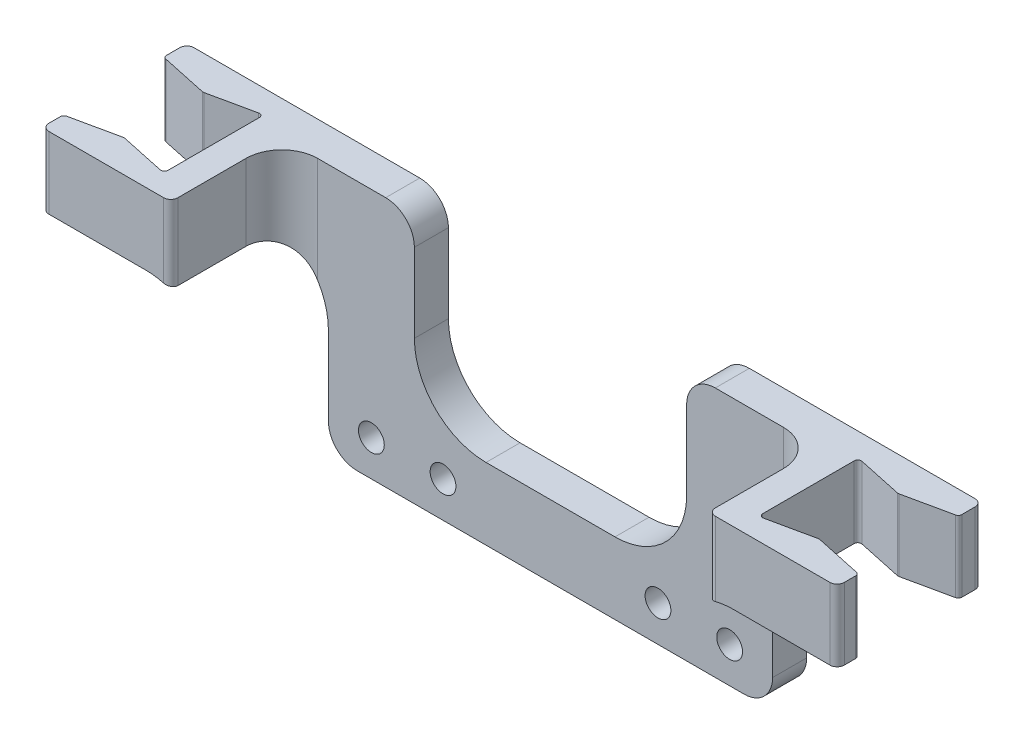
from build123d import *

# Parameters (mm, degrees)
SKETCH_1_W          = 111
SKETCH_1_H          = 35
SKETCH_1_R          = 1.8
EXTRUDE_1_DEPTH     = 4.75
SKETCH_2_W          = 4
SKETCH_2_H          = 35
EXTRUDE_2_DEPTH     = 15.5
SKETCH_3_W          = 4.5
SKETCH_3_H          = 35
EXTRUDE_3_DEPTH     = 14
SKETCH_4_W          = 4.5
SKETCH_4_H          = 35
EXTRUDE_4_DEPTH     = 14
FILLET_1_R          = 5
FILLET_2_R          = 1
SKETCH_5_W          = 20
SKETCH_5_H          = 2
CUT_EXTRUDE_1_DEPTH = 1
CUT_EXTRUDE_2_DEPTH = 200
SKETCH_8_W          = 33.5
SKETCH_8_H          = 25
SKETCH_8_W_2        = 38
CUT_EXTRUDE_3_DEPTH = 1000
FILLET_8_R          = 10
FILLET_9_R          = 4
FILLET_10_R         = 0.5


with BuildPart() as part:
    # ｽｹｯﾁ1 → ﾎﾞｽ - 押し出し1 (new body)
    with BuildSketch(Plane.XY):
        with Locations((0, -98.5)):
            Rectangle(SKETCH_1_W, SKETCH_1_H)
        with Locations((25, -111)):
            Circle(SKETCH_1_R, mode=Mode.SUBTRACT)
        with Locations((15, -111)):
            Circle(SKETCH_1_R, mode=Mode.SUBTRACT)
        with Locations((-15, -111)):
            Circle(SKETCH_1_R, mode=Mode.SUBTRACT)
        with Locations((-25, -111)):
            Circle(SKETCH_1_R, mode=Mode.SUBTRACT)
    extrude(amount=EXTRUDE_1_DEPTH)

    # ｽｹｯﾁ2 → ﾎﾞｽ - 押し出し2 (add)
    with BuildSketch(Plane.XY.offset(4.75)):
        with Locations((39.5, -98.5)):
            Rectangle(SKETCH_2_W, SKETCH_2_H)
        with Locations((-39.5, -98.5)):
            Rectangle(SKETCH_2_W, SKETCH_2_H)
    extrude(amount=EXTRUDE_2_DEPTH)

    # ｽｹｯﾁ3 → ﾎﾞｽ - 押し出し3 (add)
    with BuildSketch(Plane(origin=(41.5, 0, 0), x_dir=(0, 0, -1), z_dir=(1, 0, 0))):
        with Locations((-18, -98.5)):
            Rectangle(SKETCH_3_W, SKETCH_3_H)
    extrude(amount=EXTRUDE_3_DEPTH)

    # ｽｹｯﾁ4 → ﾎﾞｽ - 押し出し4 (add)
    with BuildSketch(Plane.ZY.offset(41.5)):
        with Locations((18, -98.5)):
            Rectangle(SKETCH_4_W, SKETCH_4_H)
    extrude(amount=EXTRUDE_4_DEPTH)

    # ﾌｨﾚｯﾄ1
    fillet_1_edges = [part.edges().sort_by_distance(p)[0] for p in [
        (37.5, -98.5, 4.75),
        (-37.5, -98.5, 4.75),
    ]]
    fillet(fillet_1_edges, radius=FILLET_1_R)

    # ﾌｨﾚｯﾄ2
    fillet_2_edges = [part.edges().sort_by_distance(p)[0] for p in [
        (37.5, -98.5, 20.25),
        (-37.5, -98.5, 20.25),
        (-55.5, -98.5, 0),
        (55.5, -98.5, 20.25),
        (55.5, -98.5, 0),
        (-55.5, -98.5, 20.25),
    ]]
    fillet(fillet_2_edges, radius=FILLET_2_R)

    # ｽｹｯﾁ5 → ｶｯﾄ - 押し出し1 (cut)
    with BuildSketch(Plane(origin=(0, -81, 0), x_dir=(1, 0, 0), z_dir=(0, 1, 0))):
        with Locations((0, -3.75)):
            Rectangle(SKETCH_5_W, SKETCH_5_H)
    extrude(amount=-CUT_EXTRUDE_1_DEPTH, mode=Mode.SUBTRACT)

    # ｽｹｯﾁ6 → ｶｯﾄ - 押し出し2 (cut)
    with BuildSketch(Plane(origin=(0, -81, 0), x_dir=(1, 0, 0), z_dir=(0, 1, 0))):
        Polygon((-55.5, -4.75), (-48.5, -4.75), (-55.5, -3.25), align=None)
        Polygon((-41.5, -4.75), (-41.5, -3.25), (-48.5, -4.75), align=None)
        Polygon((-41.5, -15.75), (-48.5, -15.75), (-41.5, -17.25), align=None)
        Polygon((-55.5, -17.25), (-48.5, -15.75), (-55.5, -15.75), align=None)
        Polygon((55.5, -4.75), (55.5, -3.25), (48.5, -4.75), align=None)
        Polygon((41.5, -4.75), (48.5, -4.75), (41.5, -3.25), align=None)
        Polygon((55.5, -15.75), (48.5, -15.75), (55.5, -17.25), align=None)
        Polygon((41.5, -15.75), (41.5, -17.25), (48.5, -15.75), align=None)
    extrude(amount=-CUT_EXTRUDE_2_DEPTH, mode=Mode.SUBTRACT)

    # ｽｹｯﾁ8 → ｶｯﾄ - 押し出し3 (cut)
    with BuildSketch(Plane(origin=(0, 0, 0), x_dir=(-1, 0, 0), z_dir=(0, 0, -1))):
        with Locations((-47.75, -103.5)):
            Rectangle(SKETCH_8_W, SKETCH_8_H)
        with Locations((0, -93.5)):
            Rectangle(SKETCH_8_W_2, SKETCH_8_H)
        with Locations((47.75, -103.5)):
            Rectangle(SKETCH_8_W, SKETCH_8_H)
    extrude(amount=-CUT_EXTRUDE_3_DEPTH, mode=Mode.SUBTRACT)

    # ﾌｨﾚｯﾄ8
    fillet_8_edges = [part.edges().sort_by_distance(p)[0] for p in [
        (-31, -91, 2.375),
        (31, -91, 2.375),
        (-19, -106, 2.375),
        (19, -106, 2.375),
    ]]
    fillet(fillet_8_edges, radius=FILLET_8_R)

    # ﾌｨﾚｯﾄ9
    fillet_9_edges = [part.edges().sort_by_distance(p)[0] for p in [
        (31, -116, 2.375),
        (-31, -116, 2.375),
        (19, -81, 2.375),
        (-19, -81, 2.375),
    ]]
    fillet(fillet_9_edges, radius=FILLET_9_R)

    # ﾌｨﾚｯﾄ10
    fillet_10_edges = [part.edges().sort_by_distance(p)[0] for p in [
        (-55.5, -86, 17.25),
        (48.5, -86, 15.75),
        (55.5, -86, 17.25),
        (48.5, -86, 4.75),
        (41.5, -86, 3.25),
        (-48.5, -86, 15.75),
        (-41.5, -86, 17.25),
        (-41.5, -86, 3.25),
        (-48.5, -86, 4.75),
        (-55.5, -86, 3.25),
        (55.5, -86, 3.25),
        (41.5, -86, 17.25),
    ]]
    fillet(fillet_10_edges, radius=FILLET_10_R)


solid = part.part
